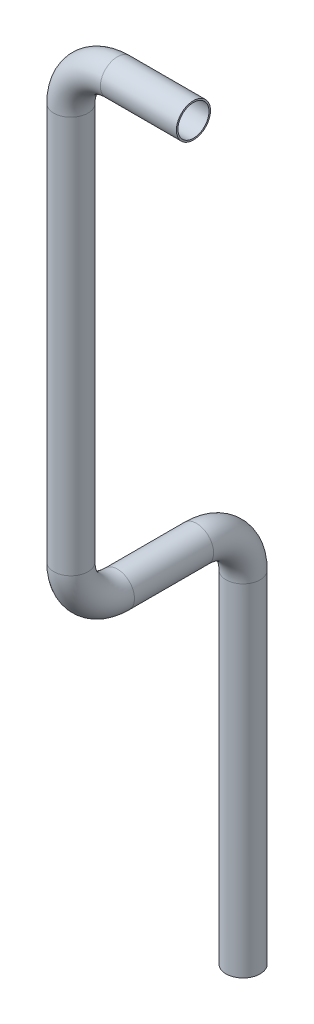
from build123d import *

# Parameters (mm, degrees)
ESQUISSE1_R   = 5.5
ESQUISSE1_R_2 = 5


with BuildPart() as part:
    # Balayage1: sweep along a curve in space
    with BuildLine() as balayage1_path:
        Line((0, 0, 0), (0, 110, 0))
        ThreePointArc((0, 110, 0), (0, 120.606601718, 4.393398282), (0, 125, 15))
        Line((0, 125, 15), (0, 125, 40.5))
        ThreePointArc((0, 125, 40.5), (0, 129.393398282, 51.106601718), (0, 140, 55.5))
        Line((0, 140, 55.5), (0, 268, 55.5))
        ThreePointArc((0, 268, 55.5), (4.393398282, 278.606601718, 55.5), (15, 283, 55.5))
        Line((15, 283, 55.5), (39.5, 283, 55.5))
    # Esquisse1 → Balayage1 (sweep)
    with BuildSketch(Plane(origin=(0, 0, 0), x_dir=(1, 0, 0), z_dir=(0, 1, 0))):
        Circle(ESQUISSE1_R)
        Circle(ESQUISSE1_R_2, mode=Mode.SUBTRACT)
    sweep(path=balayage1_path.line)


solid = part.part
